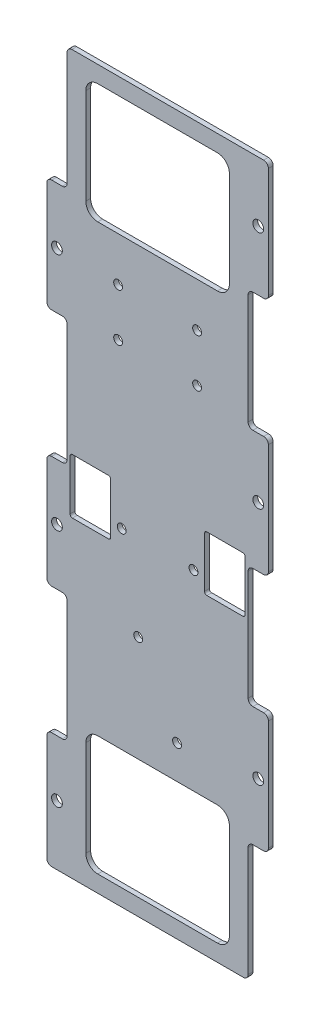
from build123d import *

# Parameters (mm, degrees)
SKETCH1_W           = 92.6
SKETCH1_H           = 300
BOSS_EXTRUDE1_DEPTH = 2
SKETCH3_R           = 2.25
SKETCH3_W           = 8.48
SKETCH3_H           = 51.5
SKETCH3_H_2         = 50
SKETCH3_H_3         = 53
CUT_EXTRUDE2_DEPTH  = 10
FILLET1_R           = 2
SKETCH4_R           = 1.85
CUT_EXTRUDE3_DEPTH  = 5
SKETCH5_R           = 1.85
CUT_EXTRUDE4_DEPTH  = 10
SKETCH6_R           = 1.85
CUT_EXTRUDE5_DEPTH  = 8.5
CUT_EXTRUDE6_DEPTH  = 8.5


with BuildPart() as part:
    # Sketch1 → Boss-Extrude1 (new body)
    with BuildSketch(Plane.XY):
        Rectangle(SKETCH1_W, SKETCH1_H)
    extrude(amount=BOSS_EXTRUDE1_DEPTH)

    # Sketch3 → Cut-Extrude2 (cut)
    with BuildSketch(Plane.XY):
        with Locations((-42.06, 75)):
            Circle(SKETCH3_R)
        with Locations((42.06, 125)):
            Circle(SKETCH3_R)
        with Locations((42.06, 25)):
            Circle(SKETCH3_R)
        with Locations((42.06, -75)):
            Circle(SKETCH3_R)
        with Locations((-42.06, -25)):
            Circle(SKETCH3_R)
        with Locations((-42.06, -125)):
            Circle(SKETCH3_R)
        with Locations((-42.06, 124.25)):
            Rectangle(SKETCH3_W, SKETCH3_H)
        with Locations((42.06, 75)):
            Rectangle(SKETCH3_W, SKETCH3_H_2)
        with Locations((42.06, -25)):
            Rectangle(SKETCH3_W, SKETCH3_H_2)
        with Locations((-42.06, 25)):
            Rectangle(SKETCH3_W, SKETCH3_H_3)
        with Locations((-42.06, -75)):
            Rectangle(SKETCH3_W, SKETCH3_H_3)
        with Locations((42.06, -125)):
            Rectangle(SKETCH3_W, SKETCH3_H_2)
    extrude(amount=CUT_EXTRUDE2_DEPTH, mode=Mode.SUBTRACT)

    # Fillet1
    fillet1_edges = [part.edges().sort_by_distance(p)[0] for p in [
        (46.3, -100, 1),
        (37.82, -100, 1),
        (37.82, -150, 1),
        (46.3, 50, 1),
        (46.3, 100, 1),
        (37.82, 100, 1),
        (37.82, 50, 1),
        (-46.3, -48.5, 1),
        (-46.3, -101.5, 1),
        (-37.82, -101.5, 1),
        (-37.82, -48.5, 1),
        (37.82, 0, 1),
        (37.82, -50, 1),
        (46.3, -50, 1),
        (46.3, 0, 1),
        (46.3, 150, 1),
        (-46.3, -150, 1),
        (-46.3, 51.5, 1),
        (-46.3, -1.5, 1),
        (-37.82, -1.5, 1),
        (-37.82, 51.5, 1),
        (-46.3, 98.5, 1),
        (-37.82, 98.5, 1),
        (-37.82, 150, 1),
    ]]
    fillet(fillet1_edges, radius=FILLET1_R)

    # Sketch4 → Cut-Extrude3 (cut)
    with BuildSketch(Plane(origin=(0, 0, 0), x_dir=(-1, 0, 0), z_dir=(0, 0, -1))):
        with Locations((-8.125, -79)):
            Circle(SKETCH4_R)
        with Locations((8.125, -48.8)):
            Circle(SKETCH4_R)
    extrude(amount=-CUT_EXTRUDE3_DEPTH, mode=Mode.SUBTRACT)

    # Sketch5 → Cut-Extrude4 (cut)
    with BuildSketch(Plane(origin=(0, 0, 0), x_dir=(-1, 0, 0), z_dir=(0, 0, -1))):
        with Locations((-15, -13)):
            Circle(SKETCH5_R)
        with Locations((15, -13)):
            Circle(SKETCH5_R)
        with BuildLine():
            Line((20.6, 3.5), (35.6, 3.5))
            ThreePointArc((35.6, 3.5), (36.307106781, 3.207106781), (36.6, 2.5))
            Line((36.6, 2.5), (36.6, -18.5))
            ThreePointArc((36.6, -18.5), (36.307106781, -19.207106781), (35.6, -19.5))
            Line((35.6, -19.5), (20.6, -19.5))
            ThreePointArc((20.6, -19.5), (19.892893219, -19.207106781), (19.6, -18.5))
            Line((19.6, -18.5), (19.6, 2.5))
            ThreePointArc((19.6, 2.5), (19.892893219, 3.207106781), (20.6, 3.5))
        make_face()
        with BuildLine():
            Line((-35.6, 3.588199514), (-20.6, 3.588199514))
            ThreePointArc((-20.6, 3.588199514), (-19.892893219, 3.295306295), (-19.6, 2.588199514))
            Line((-19.6, 2.588199514), (-19.6, -18.411800486))
            ThreePointArc((-19.6, -18.411800486), (-19.892893219, -19.118907267), (-20.6, -19.411800486))
            Line((-20.6, -19.411800486), (-35.6, -19.411800486))
            ThreePointArc((-35.6, -19.411800486), (-36.307106781, -19.118907267), (-36.6, -18.411800486))
            Line((-36.6, -18.411800486), (-36.6, 2.588199514))
            ThreePointArc((-36.6, 2.588199514), (-36.307106781, 3.295306295), (-35.6, 3.588199514))
        make_face()
    extrude(amount=-CUT_EXTRUDE4_DEPTH, mode=Mode.SUBTRACT)

    # Sketch6 → Cut-Extrude5 (cut)
    with BuildSketch(Plane(origin=(0, 0, 0), x_dir=(-1, 0, 0), z_dir=(0, 0, -1))):
        with Locations((-16.5, 74.5)):
            Circle(SKETCH6_R)
        with Locations((16.5, 74.5)):
            Circle(SKETCH6_R)
        with Locations((16.5, 54.5)):
            Circle(SKETCH6_R)
        with Locations((-16.5, 54.5)):
            Circle(SKETCH6_R)
    extrude(amount=-CUT_EXTRUDE5_DEPTH, mode=Mode.SUBTRACT)

    # Sketch7 → Cut-Extrude6 (cut)
    with BuildSketch(Plane(origin=(0, 0, 0), x_dir=(-1, 0, 0), z_dir=(0, 0, -1))):
        with BuildLine():
            Line((25, 93), (-25, 93))
            ThreePointArc((-25, 93), (-28.535533906, 94.464466094), (-30, 98))
            Line((-30, 98), (-30, 138))
            ThreePointArc((-30, 138), (-28.535533906, 141.535533906), (-25, 143))
            Line((-25, 143), (25, 143))
            ThreePointArc((25, 143), (28.535533906, 141.535533906), (30, 138))
            Line((30, 138), (30, 98))
            ThreePointArc((30, 98), (28.535533906, 94.464466094), (25, 93))
        make_face()
        with BuildLine():
            Line((25, -143), (-25, -143))
            ThreePointArc((-25, -143), (-28.535533906, -141.535533906), (-30, -138))
            Line((-30, -138), (-30, -98))
            ThreePointArc((-30, -98), (-28.535533906, -94.464466094), (-25, -93))
            Line((-25, -93), (25, -93))
            ThreePointArc((25, -93), (28.535533906, -94.464466094), (30, -98))
            Line((30, -98), (30, -138))
            ThreePointArc((30, -138), (28.535533906, -141.535533906), (25, -143))
        make_face()
    extrude(amount=-CUT_EXTRUDE6_DEPTH, mode=Mode.SUBTRACT)


solid = part.part
